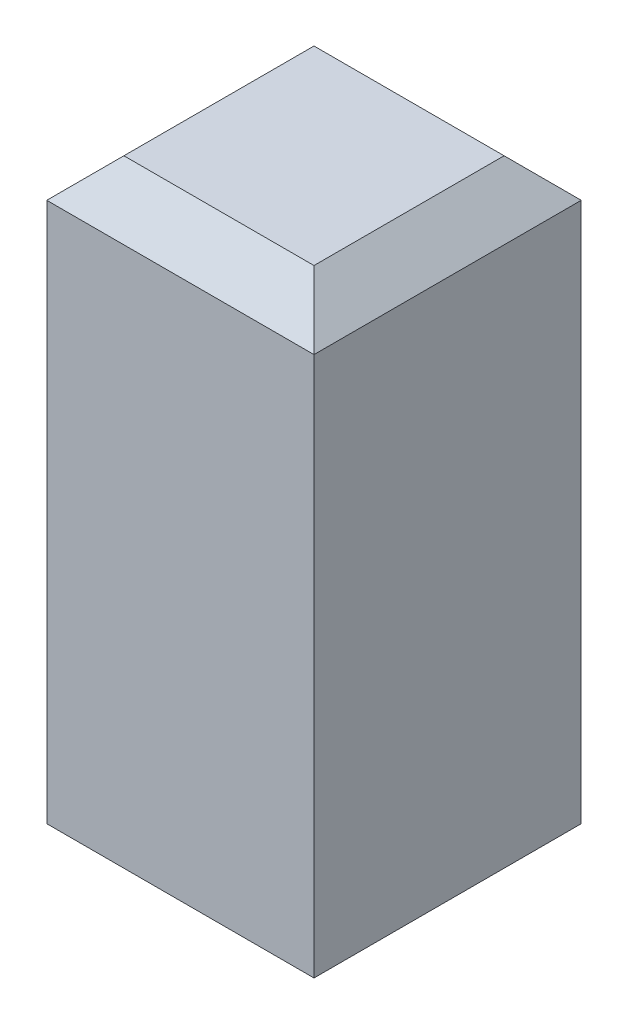
from build123d import *

# Parameters (mm, degrees)
SKETCH1_W           = 4.400325499
SKETCH1_H           = 4.400325499
BOSS_EXTRUDE1_DEPTH = 10.16
CHAMFER1_SIZE       = 0.635


with BuildPart() as part:
    # Sketch1 → Boss-Extrude1 (new body)
    with BuildSketch(Plane(origin=(0, 0, 0), x_dir=(1, 0, 0), z_dir=(0, 1, 0))):
        with Locations((2.20016275, 2.20016275)):
            Rectangle(SKETCH1_W, SKETCH1_H)
    extrude(amount=BOSS_EXTRUDE1_DEPTH)

    # Chamfer1
    chamfer1_edges = [part.edges().sort_by_distance(p)[0] for p in [
        (4.400325499, 10.16, -2.20016275),
        (2.20016275, 10.16, -4.400325499),
        (0, 10.16, -2.20016275),
        (2.20016275, 0, -4.400325499),
        (4.400325499, 0, -2.20016275),
        (2.20016275, 0, 0),
        (0, 0, -2.20016275),
        (2.20016275, 10.16, 0),
    ]]
    chamfer(chamfer1_edges, length=CHAMFER1_SIZE)


solid = part.part
